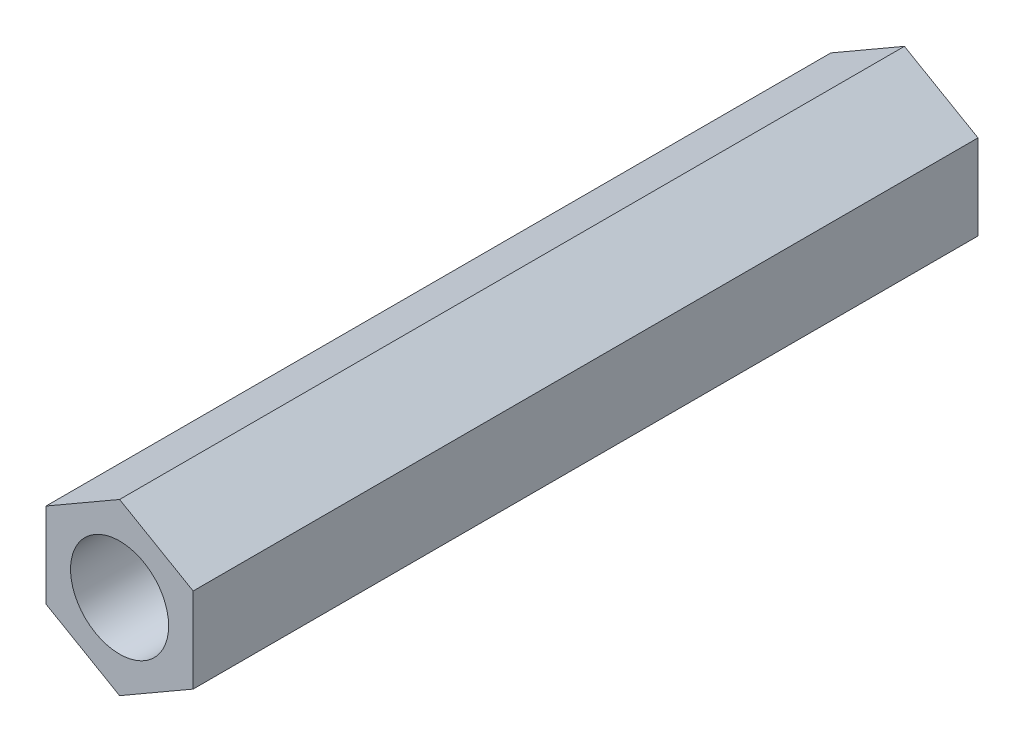
from build123d import *

# Parameters (mm, degrees)
SKETCH_1_R      = 1
EXTRUDE_1_DEPTH = 16


with BuildPart() as part:
    # 草图1 → 凸台-拉伸1 (new body)
    with BuildSketch(Plane.XY):
        Polygon((1.5, 0.866025404), (0, 1.732050808), (-1.5, 0.866025404), (-1.5, -0.866025404), (0, -1.732050808), (1.5, -0.866025404), align=None)
        Circle(SKETCH_1_R, mode=Mode.SUBTRACT)
    extrude(amount=EXTRUDE_1_DEPTH)


solid = part.part
